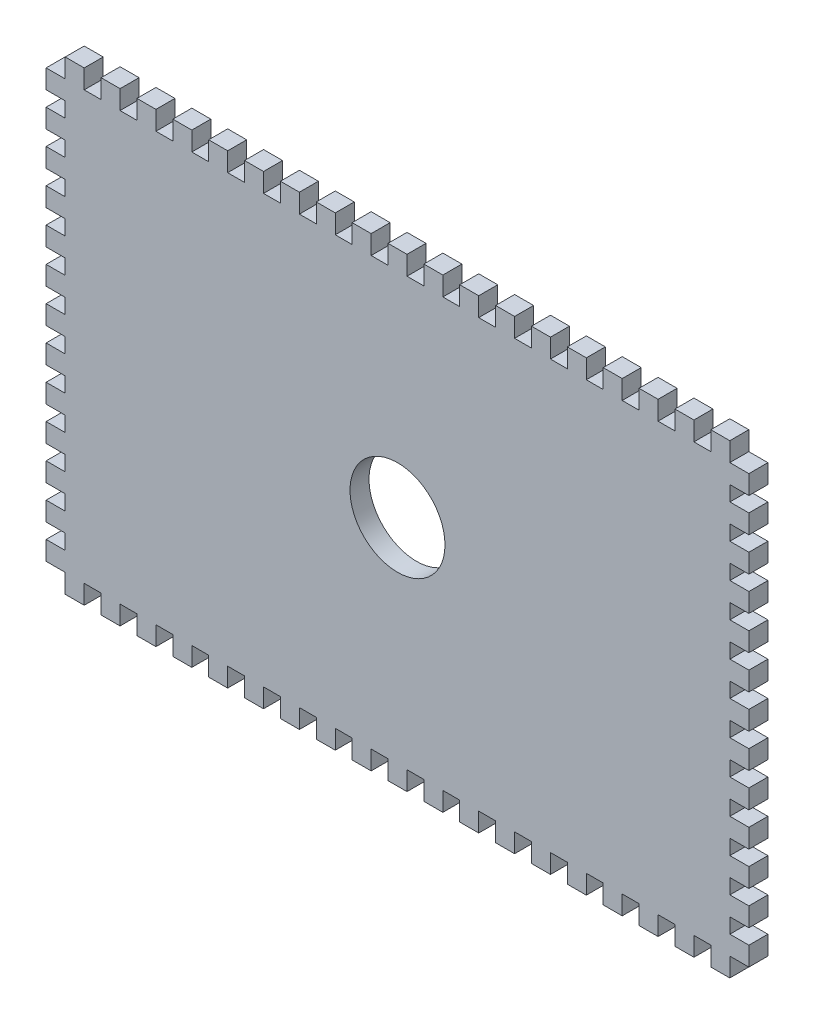
from build123d import *

# Parameters (mm, degrees)
RESSALTO_EXTRUS_O9_DEPTH  = 6
ESBO_O2_W                 = 6
ESBO_O2_H                 = 6
RESSALTO_EXTRUS_O10_DEPTH = 6
PADR_O_LINEAR1_COUNT      = 10
PADR_O_LINEAR1_PITCH      = 11.33
PADR_O_LINEAR1_COL_COUNT  = 10
PADR_O_LINEAR1_COL_PITCH  = 11.33
ESBO_O3_R                 = 15
CORTE_EXTRUS_O1_DEPTH     = 10
ESBO_O4_W                 = 6
ESBO_O4_H                 = 6
RESSALTO_EXTRUS_O11_DEPTH = 6
PADR_O_LINEAR2_COUNT      = 7
PADR_O_LINEAR2_PITCH      = 10.75
PADR_O_LINEAR2_COL_COUNT  = 7
PADR_O_LINEAR2_COL_PITCH  = 10.75


with BuildPart() as part:
    # Esboço1 → Ressalto-extrusão9 (new body)
    with BuildSketch(Plane.XY):
        Polygon((-105, -67.5), (-105, 67.5), (-2.5, 67.5), (2.5, 67.5), (105, 67.5), (105, -67.5), align=None)
    extrude(amount=RESSALTO_EXTRUS_O9_DEPTH)

    # Esboço2 → Ressalto-extrusão10 (add)
    with BuildSketch(Plane.XY.offset(6)):
        with Locations((0, 70.5)):
            Rectangle(ESBO_O2_W, ESBO_O2_H)
        with Locations((0, -70.5)):
            Rectangle(ESBO_O2_W, ESBO_O2_H)
    ressalto_extrus_o10 = extrude(amount=-RESSALTO_EXTRUS_O10_DEPTH)

    # Padrão linear1: Ressalto-extrusão10 ×10
    with Locations(*[(-i * PADR_O_LINEAR1_PITCH, 0, 0) for i in range(1, PADR_O_LINEAR1_COUNT)]):
        add(ressalto_extrus_o10)

    # Padrão linear1 col: Ressalto-extrusão10 ×10
    with Locations(*[(i * PADR_O_LINEAR1_COL_PITCH, 0, 0) for i in range(1, PADR_O_LINEAR1_COL_COUNT)]):
        add(ressalto_extrus_o10)

    # Esboço3 → Corte-extrusão1 (cut)
    with BuildSketch(Plane.XY.offset(6)):
        Circle(ESBO_O3_R)
    extrude(amount=-CORTE_EXTRUS_O1_DEPTH, mode=Mode.SUBTRACT)

    # Esboço4 → Ressalto-extrusão11 (add)
    with BuildSketch(Plane.XY.offset(6)):
        with Locations((-108, 0)):
            Rectangle(ESBO_O4_W, ESBO_O4_H)
        with Locations((108, 0)):
            Rectangle(ESBO_O4_W, ESBO_O4_H)
    ressalto_extrus_o11 = extrude(amount=-RESSALTO_EXTRUS_O11_DEPTH)

    # Padrão linear2: Ressalto-extrusão11 ×7
    with Locations(*[(0, i * PADR_O_LINEAR2_PITCH, 0) for i in range(1, PADR_O_LINEAR2_COUNT)]):
        add(ressalto_extrus_o11)

    # Padrão linear2 col: Ressalto-extrusão11 ×7
    with Locations(*[(0, -i * PADR_O_LINEAR2_COL_PITCH, 0) for i in range(1, PADR_O_LINEAR2_COL_COUNT)]):
        add(ressalto_extrus_o11)


solid = part.part
